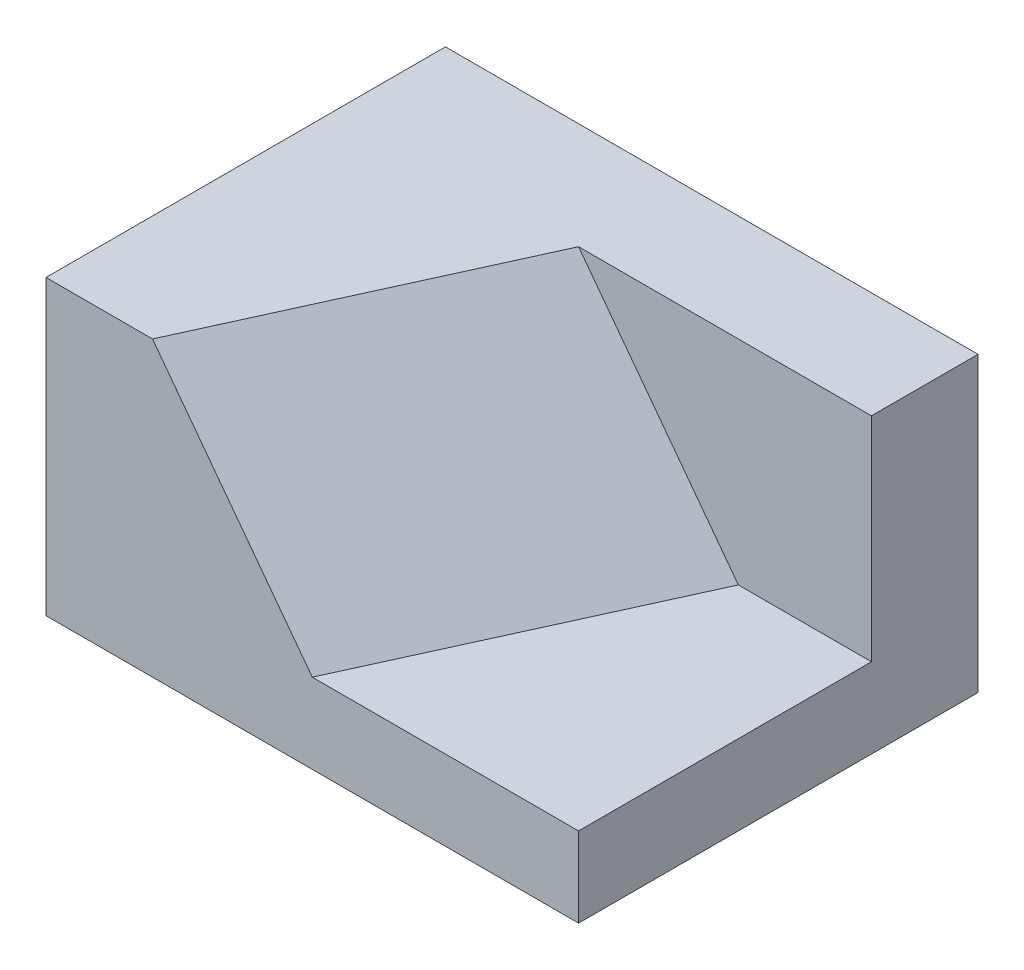
from build123d import *

# Parameters (mm, degrees)
BOSS_EXTRUDE1_DEPTH = 100
SKETCH1_3_W         = 55
SKETCH1_3_H         = 40
BOSS_EXTRUDE2_DEPTH = 75
CUT_EXTRUDE1_DEPTH  = 75


with BuildPart() as part:
    # Sketch1 → Boss-Extrude1 (new body)
    with BuildSketch(Plane(origin=(0, 0, 0), x_dir=(0, 0, -1), z_dir=(1, 0, 0))):
        Polygon((0, 55), (-20, 55), (-20, 15), (-75, 15), (-75, 0), (0, 0), align=None)
    extrude(amount=BOSS_EXTRUDE1_DEPTH)

    # Sketch1<3> → Boss-Extrude2 (add)
    with BuildSketch(Plane(origin=(0, 0, 0), x_dir=(0, 0, -1), z_dir=(1, 0, 0))):
        with Locations((-47.5, 35)):
            Rectangle(SKETCH1_3_W, SKETCH1_3_H)
    extrude(amount=BOSS_EXTRUDE2_DEPTH)

    # Sketch4 → Cut-Extrude1 (cut, along a direction that is not the sketch's normal)
    with BuildSketch(Plane(origin=(53.891970803, 40.418978102, 24.496350365), x_dir=(-0.27339445046936356, -0.2050458378520227, 0.9397934234884371), z_dir=(-0.7518347387907492, -0.5638760540930627, -0.34174306308670443))):
        Polygon((53.73909667, 32), (-4.784402883, 17), (-4.784402883, -33), (53.73909667, -18), align=None)
    extrude(amount=-CUT_EXTRUDE1_DEPTH, dir=(-1, 0, 0), mode=Mode.SUBTRACT)


solid = part.part
